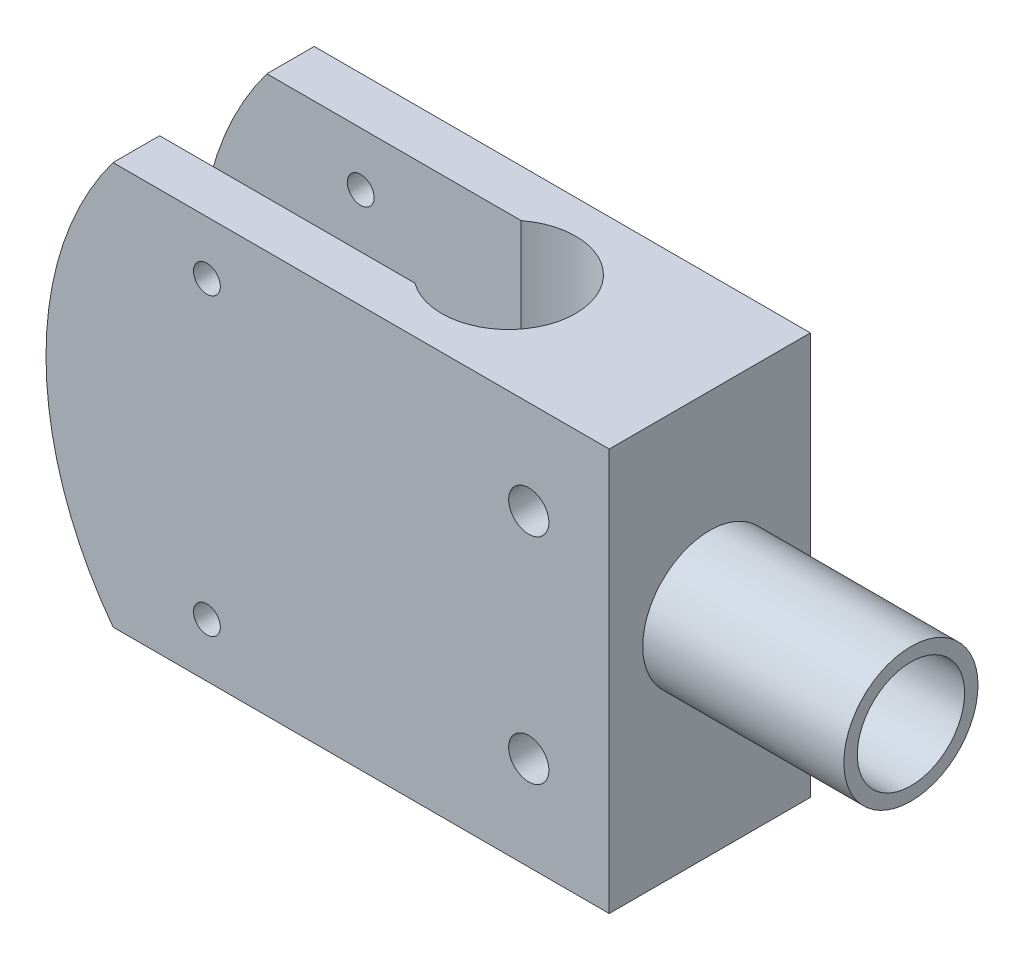
from build123d import *

# Parameters (mm, degrees)
SKETCH1_W           = 42
SKETCH1_H           = 30
BOSS_EXTRUDE1_DEPTH = 15
SKETCH3_R           = 1.5
CUT_EXTRUDE1_DEPTH  = 15
SKETCH4_R           = 5
SKETCH4_R_2         = 4
BOSS_EXTRUDE2_DEPTH = 15
CUT_EXTRUDE2_DEPTH  = 30
CUT_EXTRUDE3_DEPTH  = 30
SKETCH7_R           = 1
CUT_EXTRUDE4_DEPTH  = 30


with BuildPart() as part:
    # Sketch1 → Boss-Extrude1 (new body)
    with BuildSketch(Plane.XY):
        with Locations((21, 15)):
            Rectangle(SKETCH1_W, SKETCH1_H)
    extrude(amount=BOSS_EXTRUDE1_DEPTH)

    # Sketch3 → Cut-Extrude1 (cut)
    with BuildSketch(Plane.XY.offset(15)):
        with Locations((36, 23)):
            Circle(SKETCH3_R)
        with Locations((36, 7)):
            Circle(SKETCH3_R)
    extrude(amount=-CUT_EXTRUDE1_DEPTH, mode=Mode.SUBTRACT)

    # Sketch4 → Boss-Extrude2 (add)
    with BuildSketch(Plane(origin=(42, 0, 0), x_dir=(0, 0, -1), z_dir=(1, 0, 0))):
        with Locations(Location((-7.5, 16, 0), (0, 0, 180))):
            Circle(SKETCH4_R)
        with Locations((-7.5, 16)):
            Circle(SKETCH4_R_2, mode=Mode.SUBTRACT)
    extrude(amount=BOSS_EXTRUDE2_DEPTH)

    # Sketch5 → Cut-Extrude2 (cut)
    with BuildSketch(Plane.XZ):
        with BuildLine():
            Line((24.041336888, 11.530671481), (0, 11.530671481))
            Line((0, 11.530671481), (0, 3.530671481))
            Line((0, 3.530671481), (23.959534392, 3.530671481))
            ThreePointArc((23.959534392, 3.530671481), (31.999738628, 7.448876113), (24.041336888, 11.530671481))
        make_face()
    extrude(amount=-CUT_EXTRUDE2_DEPTH, mode=Mode.SUBTRACT)

    # Sketch6 → Cut-Extrude3 (cut)
    with BuildSketch(Plane.XY.offset(15)):
        with BuildLine():
            ThreePointArc((0, 15), (1.282917549, 22.90569415), (5, 30))
            Line((5, 30), (0, 30))
            Line((0, 30), (0, 15))
        make_face()
        with BuildLine():
            ThreePointArc((5, 0), (1.282917549, 7.09430585), (0, 15))
            Line((0, 15), (0, 0))
            Line((0, 0), (5, 0))
        make_face()
    extrude(amount=-CUT_EXTRUDE3_DEPTH, mode=Mode.SUBTRACT)

    # Sketch7 → Cut-Extrude4 (cut)
    with BuildSketch(Plane.XY.offset(15)):
        with Locations((12, 26)):
            Circle(SKETCH7_R)
        with Locations((12, 4)):
            Circle(SKETCH7_R)
    extrude(amount=-CUT_EXTRUDE4_DEPTH, mode=Mode.SUBTRACT)


solid = part.part
